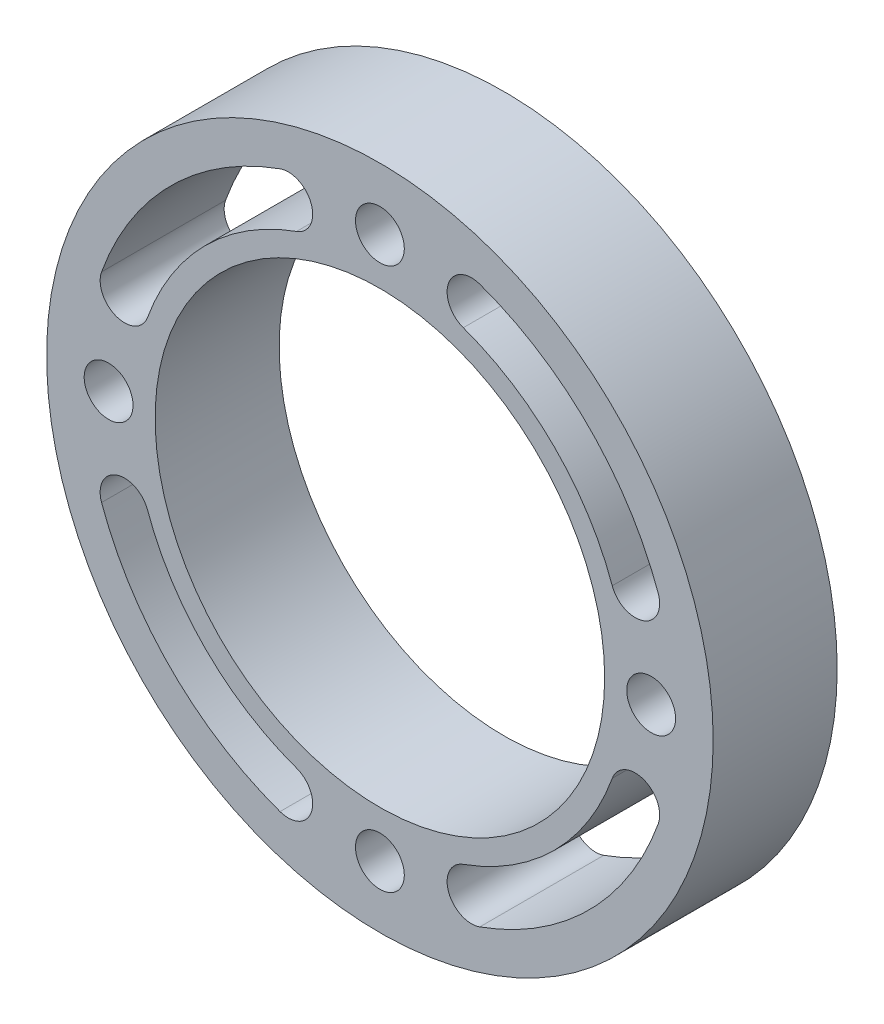
from build123d import *

# Parameters (mm, degrees)
SKETCH_1_R      = 21.5
SKETCH_1_R_2    = 14.5
SKETCH_1_R_3    = 1.575
EXTRUDE_1_DEPTH = 8


with BuildPart() as part:
    # 草图1 → 凸台-拉伸1 (new body)
    with BuildSketch(Plane.XY):
        Circle(SKETCH_1_R)
        Circle(SKETCH_1_R_2, mode=Mode.SUBTRACT)
        with Locations((0, 17.5)):
            Circle(SKETCH_1_R_3, mode=Mode.SUBTRACT)
        with Locations((17.5, 0)):
            Circle(SKETCH_1_R_3, mode=Mode.SUBTRACT)
        with Locations((0, -17.5)):
            Circle(SKETCH_1_R_3, mode=Mode.SUBTRACT)
        with Locations((-17.5, 0)):
            Circle(SKETCH_1_R_3, mode=Mode.SUBTRACT)
        with BuildLine():
            ThreePointArc((-5.379173171, 14.989), (-4.428750737, 17.003434709), (-6.443185446, 17.953857143))
            ThreePointArc((-6.443185446, 17.953857143), (-13.488061851, 13.488061851), (-17.953857143, 6.443185446))
            ThreePointArc((-17.953857143, 6.443185446), (-17.003434709, 4.428750737), (-14.989, 5.379173171))
            ThreePointArc((-14.989, 5.379173171), (-11.26067549, 11.26067549), (-5.379173171, 14.989))
        make_face(mode=Mode.SUBTRACT)
        with BuildLine():
            ThreePointArc((5.379173171, 14.989), (11.26067549, 11.26067549), (14.989, 5.379173171))
            ThreePointArc((14.989, 5.379173171), (17.003434709, 4.428750737), (17.953857143, 6.443185446))
            ThreePointArc((17.953857143, 6.443185446), (13.488061851, 13.488061851), (6.443185446, 17.953857143))
            ThreePointArc((6.443185446, 17.953857143), (4.428750737, 17.003434709), (5.379173171, 14.989))
        make_face(mode=Mode.SUBTRACT)
        with BuildLine():
            ThreePointArc((5.379173171, -14.989), (4.428750737, -17.003434709), (6.443185446, -17.953857143))
            ThreePointArc((6.443185446, -17.953857143), (13.488061851, -13.488061851), (17.953857143, -6.443185446))
            ThreePointArc((17.953857143, -6.443185446), (17.003434709, -4.428750737), (14.989, -5.379173171))
            ThreePointArc((14.989, -5.379173171), (11.26067549, -11.26067549), (5.379173171, -14.989))
        make_face(mode=Mode.SUBTRACT)
        with BuildLine():
            ThreePointArc((-5.379173171, -14.989), (-11.26067549, -11.26067549), (-14.989, -5.379173171))
            ThreePointArc((-14.989, -5.379173171), (-17.003434709, -4.428750737), (-17.953857143, -6.443185446))
            ThreePointArc((-17.953857143, -6.443185446), (-13.488061851, -13.488061851), (-6.443185446, -17.953857143))
            ThreePointArc((-6.443185446, -17.953857143), (-4.428750737, -17.003434709), (-5.379173171, -14.989))
        make_face(mode=Mode.SUBTRACT)
    extrude(amount=EXTRUDE_1_DEPTH)


solid = part.part
